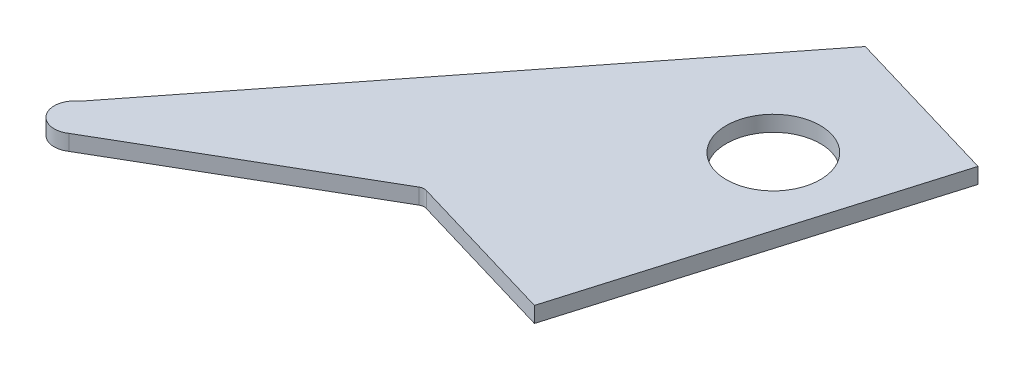
from build123d import *

# Parameters (mm, degrees)
BOSS_EXTRUDE1_DEPTH = 4.7625
SKETCH2_R           = 14.2875
CUT_EXTRUDE1_DEPTH  = 127.195863524


with BuildPart() as part:
    # Sketch1 → Boss-Extrude1 (new body)
    with BuildSketch(Plane(origin=(0, 0, 0), x_dir=(1, 0, 0), z_dir=(0, 1, 0))):
        with BuildLine():
            Line((53.854446853, 73.373362576), (102.562489384, 58.945383065))
            Line((102.562489384, 58.945383065), (71.73313232, -45.132782137))
            Line((71.73313232, -45.132782137), (24.990181224, -31.286889228))
            ThreePointArc((24.990181224, -31.286889228), (23.967852385, -31.200180886), (22.994624733, -31.524992416))
            Line((22.994624733, -31.524992416), (-44.326137807, -70.562582621))
            ThreePointArc((-44.326137807, -70.562582621), (-52.787800823, -69.037356261), (-51.262574464, -60.575693244))
            Line((-51.262574464, -60.575693244), (53.854446853, 73.373362576))
        make_face()
    extrude(amount=BOSS_EXTRUDE1_DEPTH)

    # Sketch2 → Cut-Extrude1 (cut, through all)
    with BuildSketch(Plane(origin=(0, 4.7625, 0), x_dir=(1, 0, 0), z_dir=(0, 1, 0))):
        with Locations(Location((67.804408175, 31.44842364, 0), (0, 0, 270))):
            Circle(SKETCH2_R)
    extrude(amount=-CUT_EXTRUDE1_DEPTH, mode=Mode.SUBTRACT)


solid = part.part
